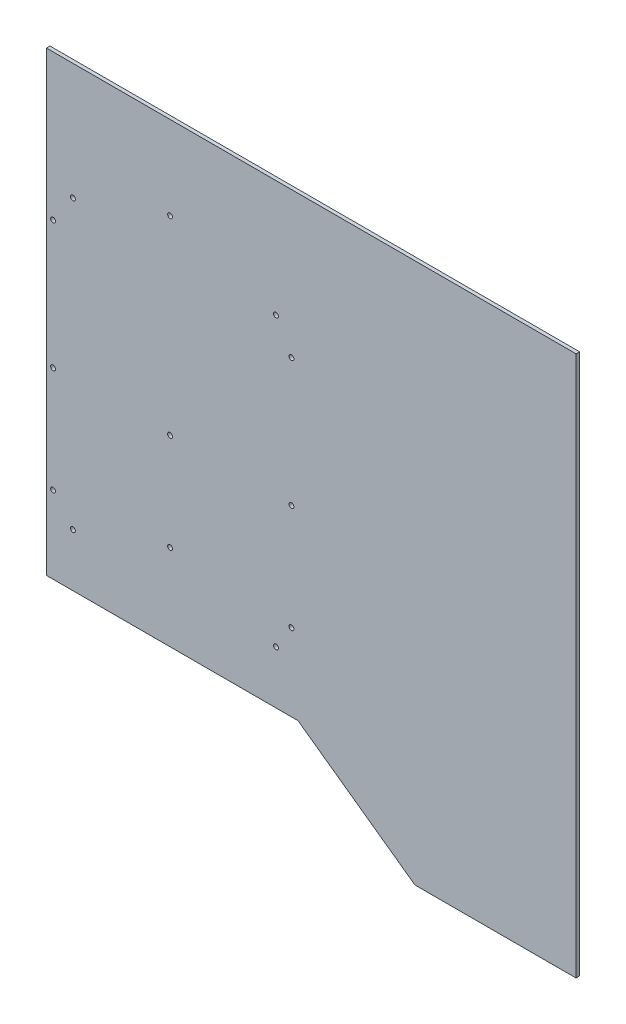
from build123d import *

# Parameters (mm, degrees)
ESTRUSIONE_ESTRUSIONE1_DEPTH = 8
SCHIZZO2_R                   = 5.5
TAGLIO_ESTRUSIONE1_DEPTH     = 8


with BuildPart() as part:
    # Schizzo1 → Estrusione-Estrusione1 (new body)
    with BuildSketch(Plane.XY):
        Polygon((-600, 600), (600, 600), (600, -625), (235, -625), (-30, -435), (-600, -435), align=None)
    extrude(amount=ESTRUSIONE_ESTRUSIONE1_DEPTH)

    # Schizzo2 → Taglio-Estrusione1 (cut)
    with BuildSketch(Plane.XY.offset(8)):
        with Locations((-585, -260)):
            Circle(SCHIZZO2_R)
        with Locations((-540, -315)):
            Circle(SCHIZZO2_R)
        with Locations((-79.872266189, -315)):
            Circle(SCHIZZO2_R)
        with Locations((-44.872266189, -260)):
            Circle(SCHIZZO2_R)
        with Locations((-44.872266189, -20)):
            Circle(SCHIZZO2_R)
        with Locations((-79.872266189, 336)):
            Circle(SCHIZZO2_R)
        with Locations((-540, 336)):
            Circle(SCHIZZO2_R)
        with Locations((-585, -20)):
            Circle(SCHIZZO2_R)
        with Locations((-585, 270)):
            Circle(SCHIZZO2_R)
        with Locations((-44.872266189, 270)):
            Circle(SCHIZZO2_R)
        with Locations((-319.872266189, 411)):
            Circle(SCHIZZO2_R)
        with Locations((-319.872266189, -20)):
            Circle(SCHIZZO2_R)
        with Locations((-319.872266189, -240)):
            Circle(SCHIZZO2_R)
    extrude(amount=-TAGLIO_ESTRUSIONE1_DEPTH, mode=Mode.SUBTRACT)


solid = part.part
